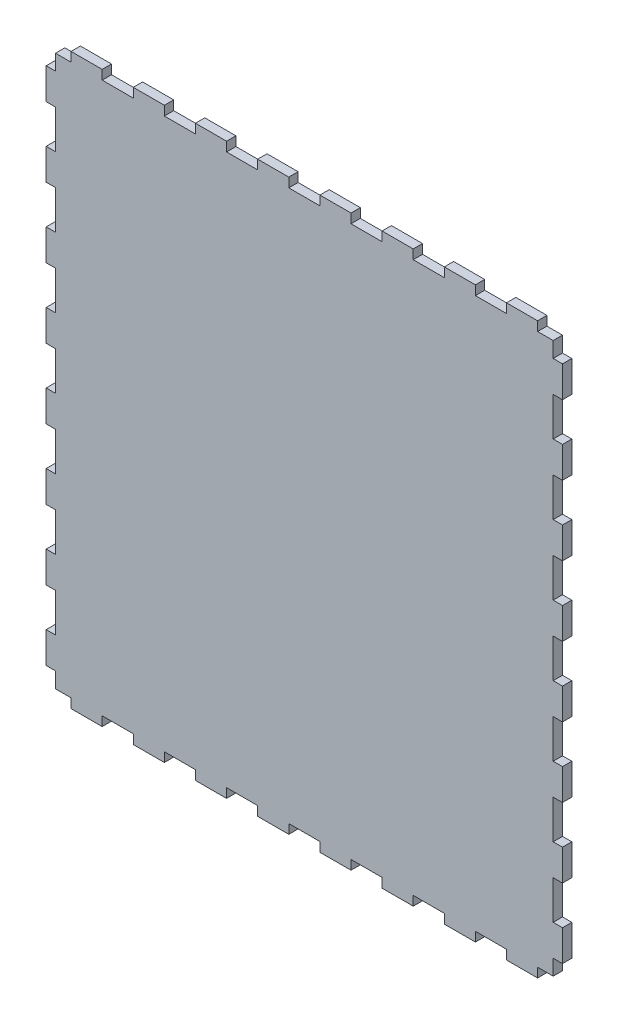
from build123d import *

# Parameters (mm, degrees)
BOSS_EXTRUDE1_DEPTH = 3


with BuildPart() as part:
    # Sketch1 → Boss-Extrude1 (new body)
    with BuildSketch(Plane.XY):
        Polygon((-39.67805095, 48.750798722), (-39.67805095, 45.750798722), (-49.67805095, 45.750798722), (-49.67805095, 48.750798722), (-59.67805095, 48.750798722), (-59.67805095, 45.750798722), (-64.67805095, 45.750798722), (-64.67805095, 40.750798722), (-67.67805095, 40.750798722), (-67.67805095, 30.750798722), (-64.67805095, 30.750798722), (-64.67805095, 18.322227293), (-67.67805095, 18.322227293), (-67.67805095, 8.322227293), (-64.67805095, 8.322227293), (-64.67805095, -4.106344135), (-67.67805095, -4.106344135), (-67.67805095, -14.106344135), (-64.67805095, -14.106344135), (-64.67805095, -26.534915564), (-67.67805095, -26.534915564), (-67.67805095, -36.534915564), (-64.67805095, -36.534915564), (-64.67805095, -48.963486992), (-67.67805095, -48.963486992), (-67.67805095, -58.963486992), (-64.67805095, -58.963486992), (-64.67805095, -71.392058421), (-67.67805095, -71.392058421), (-67.67805095, -81.392058421), (-64.67805095, -81.392058421), (-64.67805095, -93.820629849), (-67.67805095, -93.820629849), (-67.67805095, -103.820629849), (-64.67805095, -103.820629849), (-64.67805095, -116.249201278), (-67.67805095, -116.249201278), (-67.67805095, -126.249201278), (-64.67805095, -126.249201278), (-64.67805095, -131.249201278), (-59.67805095, -131.249201278), (-59.67805095, -134.249201278), (-49.67805095, -134.249201278), (-49.67805095, -131.249201278), (-39.67805095, -131.249201278), (-39.67805095, -134.249201278), (-29.67805095, -134.249201278), (-29.67805095, -131.249201278), (-19.67805095, -131.249201278), (-19.67805095, -134.249201278), (-9.67805095, -134.249201278), (-9.67805095, -131.249201278), (0.32194905, -131.249201278), (0.32194905, -134.249201278), (10.32194905, -134.249201278), (10.32194905, -131.249201278), (20.32194905, -131.249201278), (20.32194905, -134.249201278), (30.32194905, -134.249201278), (30.32194905, -131.249201278), (40.32194905, -131.249201278), (40.32194905, -134.249201278), (50.32194905, -134.249201278), (50.32194905, -131.249201278), (60.32194905, -131.249201278), (60.32194905, -134.249201278), (70.32194905, -134.249201278), (70.32194905, -131.249201278), (80.32194905, -131.249201278), (80.32194905, -134.249201278), (90.32194905, -134.249201278), (90.32194905, -131.249201278), (95.32194905, -131.249201278), (95.32194905, -126.249201278), (98.32194905, -126.249201278), (98.32194905, -116.249201278), (95.32194905, -116.249201278), (95.32194905, -103.820629849), (98.32194905, -103.820629849), (98.32194905, -93.820629849), (95.32194905, -93.820629849), (95.32194905, -81.392058421), (98.32194905, -81.392058421), (98.32194905, -71.392058421), (95.32194905, -71.392058421), (95.32194905, -58.963486992), (98.32194905, -58.963486992), (98.32194905, -48.963486992), (95.32194905, -48.963486992), (95.32194905, -36.534915564), (98.32194905, -36.534915564), (98.32194905, -26.534915564), (95.32194905, -26.534915564), (95.32194905, -14.106344135), (98.32194905, -14.106344135), (98.32194905, -4.106344135), (95.32194905, -4.106344135), (95.32194905, 8.322227293), (98.32194905, 8.322227293), (98.32194905, 18.322227293), (95.32194905, 18.322227293), (95.32194905, 30.750798722), (98.32194905, 30.750798722), (98.32194905, 40.750798722), (95.32194905, 40.750798722), (95.32194905, 45.750798722), (90.32194905, 45.750798722), (90.32194905, 48.750798722), (80.32194905, 48.750798722), (80.32194905, 45.750798722), (70.32194905, 45.750798722), (70.32194905, 48.750798722), (60.32194905, 48.750798722), (60.32194905, 45.750798722), (50.32194905, 45.750798722), (50.32194905, 48.750798722), (40.32194905, 48.750798722), (40.32194905, 45.750798722), (30.32194905, 45.750798722), (30.32194905, 48.750798722), (20.32194905, 48.750798722), (20.32194905, 45.750798722), (10.32194905, 45.750798722), (10.32194905, 48.750798722), (0.32194905, 48.750798722), (0.32194905, 45.750798722), (-9.67805095, 45.750798722), (-9.67805095, 48.750798722), (-19.67805095, 48.750798722), (-19.67805095, 45.750798722), (-29.67805095, 45.750798722), (-29.67805095, 48.750798722), align=None)
    extrude(amount=BOSS_EXTRUDE1_DEPTH)


solid = part.part
